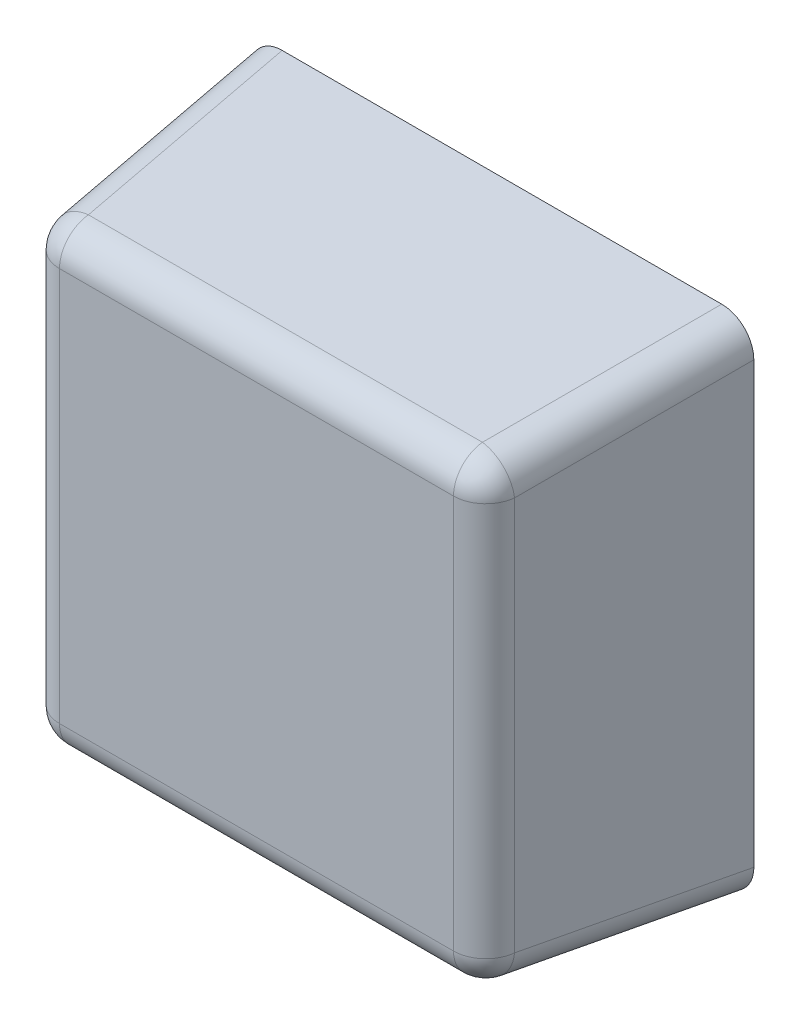
from build123d import *

# Parameters (mm, degrees)
SKETCH1_W           = 19.812
SKETCH1_H           = 19.812
BOSS_EXTRUDE1_DEPTH = 9.652
BOSS_EXTRUDE1_TAPER = 6
FILLET1_R           = 1.27


with BuildPart() as part:
    # Sketch1 → Boss-Extrude1 (new body)
    with BuildSketch(Plane.XY):
        with Locations((9.906, -9.906)):
            Rectangle(SKETCH1_W, SKETCH1_H)
    extrude(amount=BOSS_EXTRUDE1_DEPTH, taper=BOSS_EXTRUDE1_TAPER)

    # Fillet1
    fillet1_edges = [part.edges().sort_by_distance(p)[0] for p in [
        (18.797533921, -9.906, 9.652),
        (9.906, -1.014466079, 9.652),
        (1.014466079, -9.906, 9.652),
        (0.507233039, -0.507233039, 4.826),
        (19.304766961, -0.507233039, 4.826),
        (19.304766961, -19.304766961, 4.826),
        (0.507233501, -19.304766499, 4.826004395),
        (9.906, -18.797533921, 9.652),
    ]]
    fillet(fillet1_edges, radius=FILLET1_R)


solid = part.part
